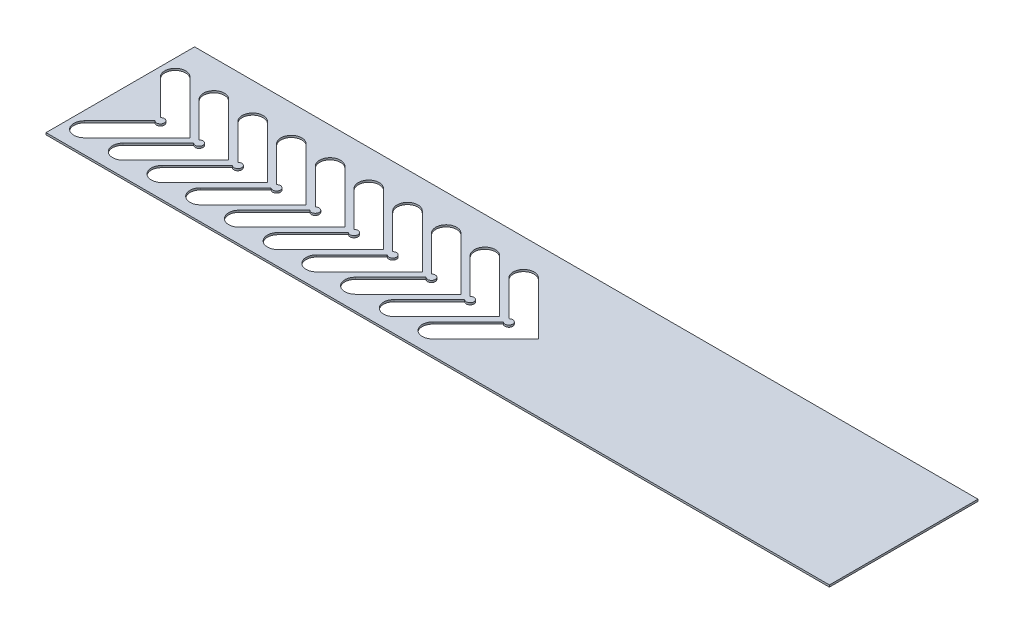
from build123d import *

# Parameters (mm, degrees)
SKETCH1_W           = 202.358038397
SKETCH1_H           = 38.375945136
BOSS_EXTRUDE1_DEPTH = 0.5


with BuildPart() as part:
    # Sketch1 → Boss-Extrude1 (new body)
    with BuildSketch(Plane(origin=(0, 0, 0), x_dir=(1, 0, 0), z_dir=(0, 1, 0))):
        with Locations((64.252599363, 1.75)):
            Rectangle(SKETCH1_W, SKETCH1_H)
        with BuildLine():
            Line((-34.635608145, 9.828784258), (-25.513930667, 0.707106781))
            ThreePointArc((-25.513930667, 0.707106781), (-23.806823886, 0), (-25.513930667, -0.707106781))
            Line((-25.513930667, -0.707106781), (-34.635608145, -9.828784258))
            ThreePointArc((-34.635608145, -9.828784258), (-34.635608145, -13.647160877), (-30.817231526, -13.647160877))
            Line((-30.817231526, -13.647160877), (-17.170070649, 0))
            Line((-17.170070649, 0), (-30.817231526, 13.647160877))
            ThreePointArc((-30.817231526, 13.647160877), (-34.635608145, 13.647160877), (-34.635608145, 9.828784258))
        make_face(mode=Mode.SUBTRACT)
        with BuildLine():
            Line((-20.817231526, 13.647160877), (-7.170070649, 0))
            Line((-7.170070649, 0), (-20.817231526, -13.647160877))
            ThreePointArc((-20.817231526, -13.647160877), (-24.635608145, -13.647160877), (-24.635608145, -9.828784258))
            Line((-24.635608145, -9.828784258), (-15.513930667, -0.707106781))
            ThreePointArc((-15.513930667, -0.707106781), (-13.806823886, 0), (-15.513930667, 0.707106781))
            Line((-15.513930667, 0.707106781), (-24.635608145, 9.828784258))
            ThreePointArc((-24.635608145, 9.828784258), (-24.635608145, 13.647160877), (-20.817231526, 13.647160877))
        make_face(mode=Mode.SUBTRACT)
        with BuildLine():
            Line((-10.817231526, 13.647160877), (2.829929351, 0))
            Line((2.829929351, 0), (-10.817231526, -13.647160877))
            ThreePointArc((-10.817231526, -13.647160877), (-14.635608145, -13.647160877), (-14.635608145, -9.828784258))
            Line((-14.635608145, -9.828784258), (-5.513930667, -0.707106781))
            ThreePointArc((-5.513930667, -0.707106781), (-3.806823886, 0), (-5.513930667, 0.707106781))
            Line((-5.513930667, 0.707106781), (-14.635608145, 9.828784258))
            ThreePointArc((-14.635608145, 9.828784258), (-14.635608145, 13.647160877), (-10.817231526, 13.647160877))
        make_face(mode=Mode.SUBTRACT)
        with BuildLine():
            Line((-0.817231526, 13.647160877), (12.829929351, 0))
            Line((12.829929351, 0), (-0.817231526, -13.647160877))
            ThreePointArc((-0.817231526, -13.647160877), (-4.635608145, -13.647160877), (-4.635608145, -9.828784258))
            Line((-4.635608145, -9.828784258), (4.486069333, -0.707106781))
            ThreePointArc((4.486069333, -0.707106781), (6.193176114, 0), (4.486069333, 0.707106781))
            Line((4.486069333, 0.707106781), (-4.635608145, 9.828784258))
            ThreePointArc((-4.635608145, 9.828784258), (-4.635608145, 13.647160877), (-0.817231526, 13.647160877))
        make_face(mode=Mode.SUBTRACT)
        with BuildLine():
            Line((9.182768474, 13.647160877), (22.829929351, 0))
            Line((22.829929351, 0), (9.182768474, -13.647160877))
            ThreePointArc((9.182768474, -13.647160877), (5.364391855, -13.647160877), (5.364391855, -9.828784258))
            Line((5.364391855, -9.828784258), (14.486069333, -0.707106781))
            ThreePointArc((14.486069333, -0.707106781), (16.193176114, 0), (14.486069333, 0.707106781))
            Line((14.486069333, 0.707106781), (5.364391855, 9.828784258))
            ThreePointArc((5.364391855, 9.828784258), (5.364391855, 13.647160877), (9.182768474, 13.647160877))
        make_face(mode=Mode.SUBTRACT)
        with BuildLine():
            Line((19.182768474, 13.647160877), (32.829929351, 0))
            Line((32.829929351, 0), (19.182768474, -13.647160877))
            ThreePointArc((19.182768474, -13.647160877), (15.364391855, -13.647160877), (15.364391855, -9.828784258))
            Line((15.364391855, -9.828784258), (24.486069333, -0.707106781))
            ThreePointArc((24.486069333, -0.707106781), (26.193176114, 0), (24.486069333, 0.707106781))
            Line((24.486069333, 0.707106781), (15.364391855, 9.828784258))
            ThreePointArc((15.364391855, 9.828784258), (15.364391855, 13.647160877), (19.182768474, 13.647160877))
        make_face(mode=Mode.SUBTRACT)
        with BuildLine():
            Line((29.182768474, 13.647160877), (42.829929351, 0))
            Line((42.829929351, 0), (29.182768474, -13.647160877))
            ThreePointArc((29.182768474, -13.647160877), (25.364391855, -13.647160877), (25.364391855, -9.828784258))
            Line((25.364391855, -9.828784258), (34.486069333, -0.707106781))
            ThreePointArc((34.486069333, -0.707106781), (36.193176114, 0), (34.486069333, 0.707106781))
            Line((34.486069333, 0.707106781), (25.364391855, 9.828784258))
            ThreePointArc((25.364391855, 9.828784258), (25.364391855, 13.647160877), (29.182768474, 13.647160877))
        make_face(mode=Mode.SUBTRACT)
        with BuildLine():
            Line((39.182768474, 13.647160877), (52.829929351, 0))
            Line((52.829929351, 0), (39.182768474, -13.647160877))
            ThreePointArc((39.182768474, -13.647160877), (35.364391855, -13.647160877), (35.364391855, -9.828784258))
            Line((35.364391855, -9.828784258), (44.486069333, -0.707106781))
            ThreePointArc((44.486069333, -0.707106781), (46.193176114, 0), (44.486069333, 0.707106781))
            Line((44.486069333, 0.707106781), (35.364391855, 9.828784258))
            ThreePointArc((35.364391855, 9.828784258), (35.364391855, 13.647160877), (39.182768474, 13.647160877))
        make_face(mode=Mode.SUBTRACT)
        with BuildLine():
            Line((49.182768474, 13.647160877), (62.829929351, 0))
            Line((62.829929351, 0), (49.182768474, -13.647160877))
            ThreePointArc((49.182768474, -13.647160877), (45.364391855, -13.647160877), (45.364391855, -9.828784258))
            Line((45.364391855, -9.828784258), (54.486069333, -0.707106781))
            ThreePointArc((54.486069333, -0.707106781), (56.193176114, 0), (54.486069333, 0.707106781))
            Line((54.486069333, 0.707106781), (45.364391855, 9.828784258))
            ThreePointArc((45.364391855, 9.828784258), (45.364391855, 13.647160877), (49.182768474, 13.647160877))
        make_face(mode=Mode.SUBTRACT)
        with BuildLine():
            Line((59.182768474, 13.647160877), (72.829929351, 0))
            Line((72.829929351, 0), (59.182768474, -13.647160877))
            ThreePointArc((59.182768474, -13.647160877), (55.364391855, -13.647160877), (55.364391855, -9.828784258))
            Line((55.364391855, -9.828784258), (64.486069333, -0.707106781))
            ThreePointArc((64.486069333, -0.707106781), (66.193176114, 0), (64.486069333, 0.707106781))
            Line((64.486069333, 0.707106781), (55.364391855, 9.828784258))
            ThreePointArc((55.364391855, 9.828784258), (55.364391855, 13.647160877), (59.182768474, 13.647160877))
        make_face(mode=Mode.SUBTRACT)
    extrude(amount=BOSS_EXTRUDE1_DEPTH)


solid = part.part
